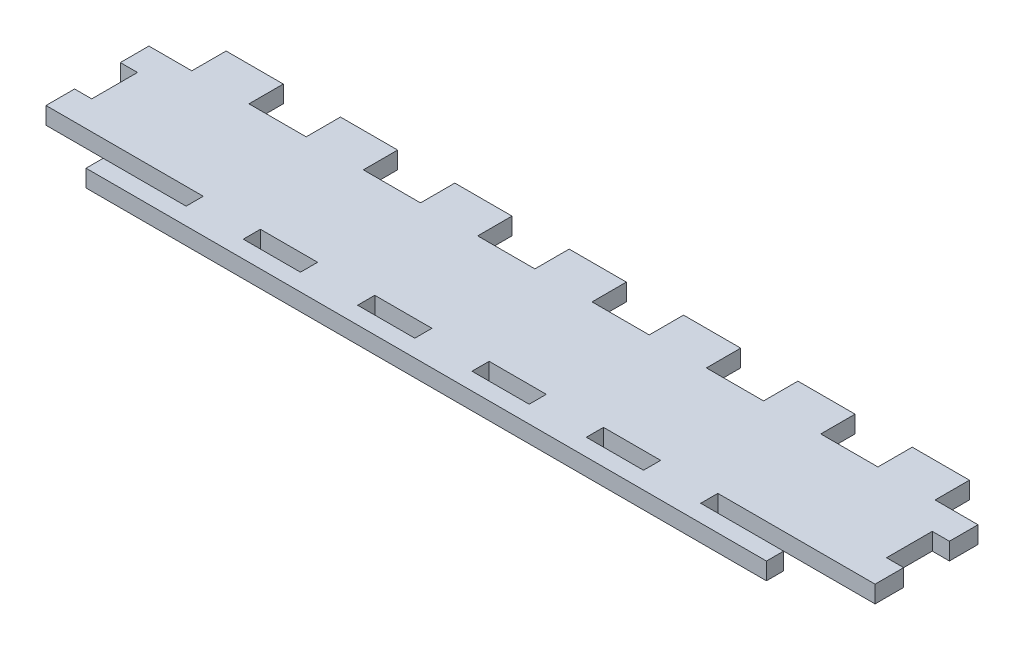
from build123d import *

# Parameters (mm, degrees)
SKETCH1_W           = 145
SKETCH1_H           = 18
BOSS_EXTRUDE1_DEPTH = 3
SKETCH2_W           = 10
SKETCH2_H           = 3
SKETCH2_H_2         = 6
BOSS_EXTRUDE2_DEPTH = 3
LPATTERN1_COUNT     = 4
LPATTERN1_PITCH     = 20
LPATTERN1_COL_COUNT = 4
LPATTERN1_COL_PITCH = 20
SKETCH3_W           = 145
SKETCH3_H           = 3
BOSS_EXTRUDE3_DEPTH = 3
SKETCH4_W           = 10
SKETCH4_H           = 3
CUT_EXTRUDE1_DEPTH  = 148.003401321
SKETCH5_W           = 13
SKETCH5_H           = 3
CUT_EXTRUDE2_DEPTH  = 148.003401321
SKETCH6_W           = 3
SKETCH6_H           = 8
CUT_EXTRUDE3_DEPTH  = 148.003401321


with BuildPart() as part:
    # Sketch1 → Boss-Extrude1 (new body)
    with BuildSketch(Plane(origin=(0, 0, 0), x_dir=(1, 0, 0), z_dir=(0, 1, 0))):
        with Locations((72.5, -9)):
            Rectangle(SKETCH1_W, SKETCH1_H)
    extrude(amount=BOSS_EXTRUDE1_DEPTH)

    # Sketch2 → Boss-Extrude2 (add, through all)
    with BuildSketch(Plane.XZ):
        with Locations((72.5, 19.5)):
            Rectangle(SKETCH2_W, SKETCH2_H)
        with Locations((72.5, -3)):
            Rectangle(SKETCH2_W, SKETCH2_H_2)
    boss_extrude2 = extrude(amount=-BOSS_EXTRUDE2_DEPTH)

    # LPattern1: Boss-Extrude2 ×4
    with Locations(*[(i * LPATTERN1_PITCH, 0, 0) for i in range(1, LPATTERN1_COUNT)]):
        add(boss_extrude2)

    # LPattern1 col: Boss-Extrude2 ×4
    with Locations(*[(-i * LPATTERN1_COL_PITCH, 0, 0) for i in range(1, LPATTERN1_COL_COUNT)]):
        add(boss_extrude2)

    # Sketch3 → Boss-Extrude3 (add, through all)
    with BuildSketch(Plane(origin=(0, 3, 0), x_dir=(1, 0, 0), z_dir=(0, 1, 0))):
        with Locations((72.5, -22.5)):
            Rectangle(SKETCH3_W, SKETCH3_H)
    extrude(amount=-BOSS_EXTRUDE3_DEPTH)

    # Sketch4 → Cut-Extrude1 (cut, through all)
    with BuildSketch(Plane(origin=(0, 3, 0), x_dir=(1, 0, 0), z_dir=(0, 1, 0))):
        with Locations((12.5, -19.5)):
            Rectangle(SKETCH4_W, SKETCH4_H)
        with Locations((132.5, -19.5)):
            Rectangle(SKETCH4_W, SKETCH4_H)
    extrude(amount=-CUT_EXTRUDE1_DEPTH, mode=Mode.SUBTRACT)

    # Sketch5 → Cut-Extrude2 (cut, through all)
    with BuildSketch(Plane(origin=(0, 3, 0), x_dir=(1, 0, 0), z_dir=(0, 1, 0))):
        with Locations((6.5, -22.5)):
            Rectangle(SKETCH5_W, SKETCH5_H)
        with Locations((138.5, -22.5)):
            Rectangle(SKETCH5_W, SKETCH5_H)
    extrude(amount=-CUT_EXTRUDE2_DEPTH, mode=Mode.SUBTRACT)

    # Sketch6 → Cut-Extrude3 (cut, through all)
    with BuildSketch(Plane.XZ):
        with Locations((1.5, 9)):
            Rectangle(SKETCH6_W, SKETCH6_H)
        with Locations((143.5, 9)):
            Rectangle(SKETCH6_W, SKETCH6_H)
    extrude(amount=-CUT_EXTRUDE3_DEPTH, mode=Mode.SUBTRACT)


solid = part.part
